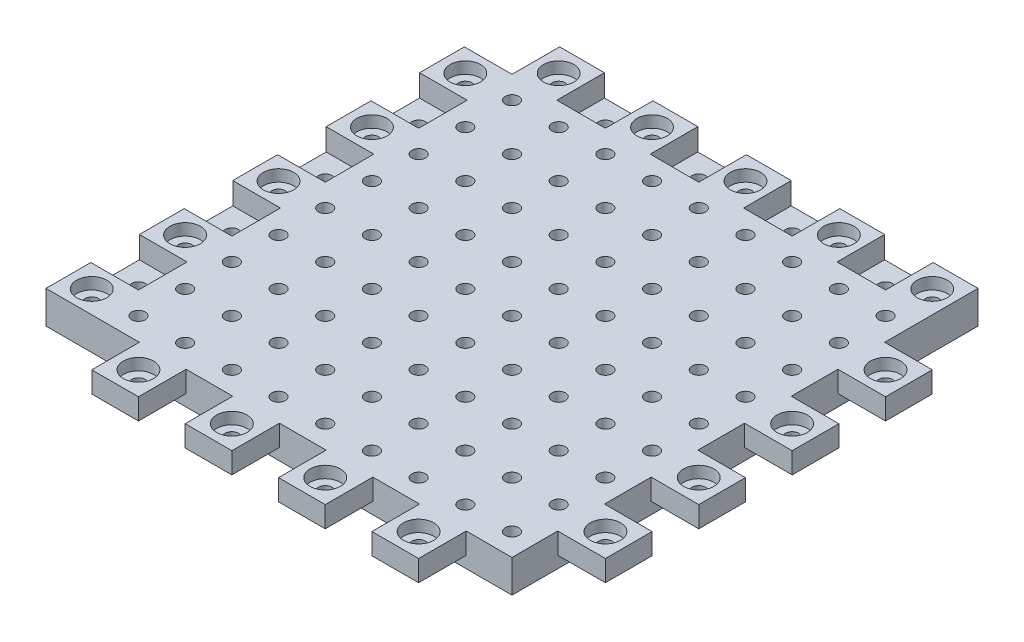
from build123d import *

# Parameters (mm, degrees)
CROQUIS1_W              = 100
CROQUIS1_H              = 100
SALIENTE_EXTRUIR1_DEPTH = 7
CROQUIS2_W              = 10.4
CROQUIS2_H              = 10.4
CORTAR_EXTRUIR1_DEPTH   = 4.7
CROQUIS3_W              = 10
CROQUIS3_H              = 10
SALIENTE_EXTRUIR2_DEPTH = 4.5
CROQUIS4_R              = 1.45
CORTAR_EXTRUIR2_DEPTH   = 7
CROQUIS5_R              = 3.25
CORTAR_EXTRUIR4_DEPTH   = 2.5
CROQUIS6_W              = 10
CROQUIS6_H              = 0.2
CROQUIS6_W_2            = 0.2
CROQUIS6_H_2            = 9.8
CORTAR_EXTRUIR5_DEPTH   = 7
CROQUIS8_W              = 10.2
CROQUIS8_H              = 10
CORTAR_EXTRUIR7_DEPTH   = 7
CROQUIS9_W              = 10.012239445
CROQUIS9_H              = 0.2
CROQUIS9_W_2            = 0.2
CROQUIS9_H_2            = 10.2
CORTAR_EXTRUIR9_DEPTH   = 2.5
CROQUIS10_W             = 0.2
CROQUIS10_H             = 0.2
CORTAR_EXTRUIR11_DEPTH  = 5
CROQUIS11_W             = 10
CROQUIS11_H             = 10.2
CROQUIS11_W_2           = 10.2
CORTAR_EXTRUIR12_DEPTH  = 10


with BuildPart() as part:
    # Croquis1 → Saliente-Extruir1 (new body)
    with BuildSketch(Plane(origin=(0, 0, 0), x_dir=(1, 0, 0), z_dir=(0, 1, 0))):
        Rectangle(CROQUIS1_W, CROQUIS1_H)
    extrude(amount=SALIENTE_EXTRUIR1_DEPTH)

    # Croquis2 → Cortar-Extruir1 (cut)
    with BuildSketch(Plane(origin=(0, 7, 0), x_dir=(1, 0, 0), z_dir=(0, 1, 0))):
        with Locations((-45, 45)):
            Rectangle(CROQUIS2_W, CROQUIS2_H)
        with Locations((-25, 45)):
            Rectangle(CROQUIS2_W, CROQUIS2_H)
        with Locations((-5, 45)):
            Rectangle(CROQUIS2_W, CROQUIS2_H)
        with Locations((15, 45)):
            Rectangle(CROQUIS2_W, CROQUIS2_H)
        with Locations((35, 45)):
            Rectangle(CROQUIS2_W, CROQUIS2_H)
        with Locations((-45, 25)):
            Rectangle(CROQUIS2_W, CROQUIS2_H)
        with Locations((-45, 5)):
            Rectangle(CROQUIS2_W, CROQUIS2_H)
        with Locations((-45, -15)):
            Rectangle(CROQUIS2_W, CROQUIS2_H)
        with Locations((-45, -35)):
            Rectangle(CROQUIS2_W, CROQUIS2_H)
    extrude(amount=-CORTAR_EXTRUIR1_DEPTH, mode=Mode.SUBTRACT)

    # Croquis3 → Saliente-Extruir2 (add)
    with BuildSketch(Plane(origin=(0, 7, 0), x_dir=(1, 0, 0), z_dir=(0, 1, 0))):
        with Locations((55, 25)):
            Rectangle(CROQUIS3_W, CROQUIS3_H)
        with Locations((55, 45)):
            Rectangle(CROQUIS3_W, CROQUIS3_H)
        with Locations((55, 5)):
            Rectangle(CROQUIS3_W, CROQUIS3_H)
        with Locations((55, -15)):
            Rectangle(CROQUIS3_W, CROQUIS3_H)
        with Locations((55, -35)):
            Rectangle(CROQUIS3_W, CROQUIS3_H)
        with Locations((-25, -55)):
            Rectangle(CROQUIS3_W, CROQUIS3_H)
        with Locations((-45, -55)):
            Rectangle(CROQUIS3_W, CROQUIS3_H)
        with Locations((-5, -55)):
            Rectangle(CROQUIS3_W, CROQUIS3_H)
        with Locations((15, -55)):
            Rectangle(CROQUIS3_W, CROQUIS3_H)
        with Locations((35, -55)):
            Rectangle(CROQUIS3_W, CROQUIS3_H)
    extrude(amount=-SALIENTE_EXTRUIR2_DEPTH)

    # Croquis4 → Cortar-Extruir2 (cut)
    with BuildSketch(Plane(origin=(0, 7, 0), x_dir=(1, 0, 0), z_dir=(0, 1, 0))):
        with Locations(Location((-45, 45, 0), (0, 0, 270))):
            Circle(CROQUIS4_R)
        with Locations(Location((-35, 45, 0), (0, 0, 270))):
            Circle(CROQUIS4_R)
        with Locations(Location((-25, 45, 0), (0, 0, 270))):
            Circle(CROQUIS4_R)
        with Locations(Location((-15, 45, 0), (0, 0, 270))):
            Circle(CROQUIS4_R)
        with Locations(Location((-5, 45, 0), (0, 0, 270))):
            Circle(CROQUIS4_R)
        with Locations(Location((5, 45, 0), (0, 0, 270))):
            Circle(CROQUIS4_R)
        with Locations(Location((15, 45, 0), (0, 0, 270))):
            Circle(CROQUIS4_R)
        with Locations(Location((25, 45, 0), (0, 0, 270))):
            Circle(CROQUIS4_R)
        with Locations(Location((35, 45, 0), (0, 0, 270))):
            Circle(CROQUIS4_R)
        with Locations(Location((45, 45, 0), (0, 0, 270))):
            Circle(CROQUIS4_R)
        with Locations(Location((55, 45, 0), (0, 0, 270))):
            Circle(CROQUIS4_R)
        with Locations(Location((-35, 35, 0), (0, 0, 270))):
            Circle(CROQUIS4_R)
        with Locations(Location((-25, 35, 0), (0, 0, 270))):
            Circle(CROQUIS4_R)
        with Locations(Location((-15, 35, 0), (0, 0, 270))):
            Circle(CROQUIS4_R)
        with Locations(Location((-5, 35, 0), (0, 0, 270))):
            Circle(CROQUIS4_R)
        with Locations(Location((5, 35, 0), (0, 0, 270))):
            Circle(CROQUIS4_R)
        with Locations(Location((15, 35, 0), (0, 0, 270))):
            Circle(CROQUIS4_R)
        with Locations(Location((25, 35, 0), (0, 0, 270))):
            Circle(CROQUIS4_R)
        with Locations(Location((35, 35, 0), (0, 0, 270))):
            Circle(CROQUIS4_R)
        with Locations(Location((45, 35, 0), (0, 0, 270))):
            Circle(CROQUIS4_R)
        with Locations((55, 35)):
            Circle(CROQUIS4_R)
        with Locations(Location((-35, 25, 0), (0, 0, 270))):
            Circle(CROQUIS4_R)
        with Locations(Location((-25, 25, 0), (0, 0, 270))):
            Circle(CROQUIS4_R)
        with Locations(Location((-15, 25, 0), (0, 0, 270))):
            Circle(CROQUIS4_R)
        with Locations(Location((-5, 25, 0), (0, 0, 270))):
            Circle(CROQUIS4_R)
        with Locations(Location((5, 25, 0), (0, 0, 270))):
            Circle(CROQUIS4_R)
        with Locations(Location((15, 25, 0), (0, 0, 270))):
            Circle(CROQUIS4_R)
        with Locations(Location((25, 25, 0), (0, 0, 270))):
            Circle(CROQUIS4_R)
        with Locations(Location((35, 25, 0), (0, 0, 270))):
            Circle(CROQUIS4_R)
        with Locations(Location((45, 25, 0), (0, 0, 270))):
            Circle(CROQUIS4_R)
        with Locations(Location((55, 25, 0), (0, 0, 270))):
            Circle(CROQUIS4_R)
        with Locations(Location((-35, 15, 0), (0, 0, 270))):
            Circle(CROQUIS4_R)
        with Locations(Location((-25, 15, 0), (0, 0, 270))):
            Circle(CROQUIS4_R)
        with Locations(Location((-15, 15, 0), (0, 0, 270))):
            Circle(CROQUIS4_R)
        with Locations(Location((-5, 15, 0), (0, 0, 270))):
            Circle(CROQUIS4_R)
        with Locations(Location((5, 15, 0), (0, 0, 270))):
            Circle(CROQUIS4_R)
        with Locations(Location((15, 15, 0), (0, 0, 270))):
            Circle(CROQUIS4_R)
        with Locations(Location((25, 15, 0), (0, 0, 270))):
            Circle(CROQUIS4_R)
        with Locations(Location((35, 15, 0), (0, 0, 270))):
            Circle(CROQUIS4_R)
        with Locations(Location((45, 15, 0), (0, 0, 270))):
            Circle(CROQUIS4_R)
        with Locations((55, 15)):
            Circle(CROQUIS4_R)
        with Locations(Location((-35, 5, 0), (0, 0, 270))):
            Circle(CROQUIS4_R)
        with Locations(Location((-25, 5, 0), (0, 0, 270))):
            Circle(CROQUIS4_R)
        with Locations(Location((-15, 5, 0), (0, 0, 270))):
            Circle(CROQUIS4_R)
        with Locations(Location((-5, 5, 0), (0, 0, 270))):
            Circle(CROQUIS4_R)
        with Locations(Location((5, 5, 0), (0, 0, 270))):
            Circle(CROQUIS4_R)
        with Locations(Location((15, 5, 0), (0, 0, 270))):
            Circle(CROQUIS4_R)
        with Locations(Location((25, 5, 0), (0, 0, 270))):
            Circle(CROQUIS4_R)
        with Locations(Location((35, 5, 0), (0, 0, 270))):
            Circle(CROQUIS4_R)
        with Locations(Location((45, 5, 0), (0, 0, 270))):
            Circle(CROQUIS4_R)
        with Locations(Location((55, 5, 0), (0, 0, 270))):
            Circle(CROQUIS4_R)
        with Locations(Location((-35, -5, 0), (0, 0, 270))):
            Circle(CROQUIS4_R)
        with Locations(Location((-25, -5, 0), (0, 0, 270))):
            Circle(CROQUIS4_R)
        with Locations(Location((-15, -5, 0), (0, 0, 270))):
            Circle(CROQUIS4_R)
        with Locations(Location((-5, -5, 0), (0, 0, 270))):
            Circle(CROQUIS4_R)
        with Locations(Location((5, -5, 0), (0, 0, 270))):
            Circle(CROQUIS4_R)
        with Locations(Location((15, -5, 0), (0, 0, 270))):
            Circle(CROQUIS4_R)
        with Locations(Location((25, -5, 0), (0, 0, 270))):
            Circle(CROQUIS4_R)
        with Locations(Location((35, -5, 0), (0, 0, 270))):
            Circle(CROQUIS4_R)
        with Locations(Location((45, -5, 0), (0, 0, 270))):
            Circle(CROQUIS4_R)
        with Locations((55, -5)):
            Circle(CROQUIS4_R)
        with Locations(Location((-35, -15, 0), (0, 0, 270))):
            Circle(CROQUIS4_R)
        with Locations(Location((-25, -15, 0), (0, 0, 270))):
            Circle(CROQUIS4_R)
        with Locations(Location((-15, -15, 0), (0, 0, 270))):
            Circle(CROQUIS4_R)
        with Locations(Location((-5, -15, 0), (0, 0, 270))):
            Circle(CROQUIS4_R)
        with Locations(Location((5, -15, 0), (0, 0, 270))):
            Circle(CROQUIS4_R)
        with Locations(Location((15, -15, 0), (0, 0, 270))):
            Circle(CROQUIS4_R)
        with Locations(Location((25, -15, 0), (0, 0, 270))):
            Circle(CROQUIS4_R)
        with Locations(Location((35, -15, 0), (0, 0, 270))):
            Circle(CROQUIS4_R)
        with Locations(Location((45, -15, 0), (0, 0, 270))):
            Circle(CROQUIS4_R)
        with Locations(Location((55, -15, 0), (0, 0, 270))):
            Circle(CROQUIS4_R)
        with Locations(Location((-35, -25, 0), (0, 0, 270))):
            Circle(CROQUIS4_R)
        with Locations(Location((-25, -25, 0), (0, 0, 270))):
            Circle(CROQUIS4_R)
        with Locations(Location((-15, -25, 0), (0, 0, 270))):
            Circle(CROQUIS4_R)
        with Locations(Location((-5, -25, 0), (0, 0, 270))):
            Circle(CROQUIS4_R)
        with Locations(Location((5, -25, 0), (0, 0, 270))):
            Circle(CROQUIS4_R)
        with Locations(Location((15, -25, 0), (0, 0, 270))):
            Circle(CROQUIS4_R)
        with Locations(Location((25, -25, 0), (0, 0, 270))):
            Circle(CROQUIS4_R)
        with Locations(Location((35, -25, 0), (0, 0, 270))):
            Circle(CROQUIS4_R)
        with Locations(Location((45, -25, 0), (0, 0, 270))):
            Circle(CROQUIS4_R)
        with Locations((55, -25)):
            Circle(CROQUIS4_R)
        with Locations(Location((-35, -35, 0), (0, 0, 270))):
            Circle(CROQUIS4_R)
        with Locations(Location((-25, -35, 0), (0, 0, 270))):
            Circle(CROQUIS4_R)
        with Locations(Location((-15, -35, 0), (0, 0, 270))):
            Circle(CROQUIS4_R)
        with Locations(Location((-5, -35, 0), (0, 0, 270))):
            Circle(CROQUIS4_R)
        with Locations(Location((5, -35, 0), (0, 0, 270))):
            Circle(CROQUIS4_R)
        with Locations(Location((15, -35, 0), (0, 0, 270))):
            Circle(CROQUIS4_R)
        with Locations(Location((25, -35, 0), (0, 0, 270))):
            Circle(CROQUIS4_R)
        with Locations(Location((35, -35, 0), (0, 0, 270))):
            Circle(CROQUIS4_R)
        with Locations(Location((45, -35, 0), (0, 0, 270))):
            Circle(CROQUIS4_R)
        with Locations(Location((55, -35, 0), (0, 0, 270))):
            Circle(CROQUIS4_R)
        with Locations(Location((-35, -45, 0), (0, 0, 270))):
            Circle(CROQUIS4_R)
        with Locations(Location((-25, -45, 0), (0, 0, 270))):
            Circle(CROQUIS4_R)
        with Locations(Location((-15, -45, 0), (0, 0, 270))):
            Circle(CROQUIS4_R)
        with Locations(Location((-5, -45, 0), (0, 0, 270))):
            Circle(CROQUIS4_R)
        with Locations(Location((5, -45, 0), (0, 0, 270))):
            Circle(CROQUIS4_R)
        with Locations(Location((15, -45, 0), (0, 0, 270))):
            Circle(CROQUIS4_R)
        with Locations(Location((25, -45, 0), (0, 0, 270))):
            Circle(CROQUIS4_R)
        with Locations(Location((35, -45, 0), (0, 0, 270))):
            Circle(CROQUIS4_R)
        with Locations(Location((45, -45, 0), (0, 0, 270))):
            Circle(CROQUIS4_R)
        with Locations((55, -45)):
            Circle(CROQUIS4_R)
        with Locations((-35, -55)):
            Circle(CROQUIS4_R)
        with Locations(Location((-25, -55, 0), (0, 0, 270))):
            Circle(CROQUIS4_R)
        with Locations((-15, -55)):
            Circle(CROQUIS4_R)
        with Locations(Location((-5, -55, 0), (0, 0, 270))):
            Circle(CROQUIS4_R)
        with Locations((5, -55)):
            Circle(CROQUIS4_R)
        with Locations(Location((15, -55, 0), (0, 0, 270))):
            Circle(CROQUIS4_R)
        with Locations((25, -55)):
            Circle(CROQUIS4_R)
        with Locations(Location((35, -55, 0), (0, 0, 270))):
            Circle(CROQUIS4_R)
        with Locations((45, -55)):
            Circle(CROQUIS4_R)
        with Locations((55, -55)):
            Circle(CROQUIS4_R)
        with Locations(Location((-45, 35, 0), (0, 0, 270))):
            Circle(CROQUIS4_R)
        with Locations(Location((-45, 25, 0), (0, 0, 270))):
            Circle(CROQUIS4_R)
        with Locations(Location((-45, 15, 0), (0, 0, 270))):
            Circle(CROQUIS4_R)
        with Locations(Location((-45, 5, 0), (0, 0, 270))):
            Circle(CROQUIS4_R)
        with Locations(Location((-45, -5, 0), (0, 0, 270))):
            Circle(CROQUIS4_R)
        with Locations(Location((-45, -15, 0), (0, 0, 270))):
            Circle(CROQUIS4_R)
        with Locations(Location((-45, -25, 0), (0, 0, 270))):
            Circle(CROQUIS4_R)
        with Locations(Location((-45, -35, 0), (0, 0, 270))):
            Circle(CROQUIS4_R)
        with Locations(Location((-45, -45, 0), (0, 0, 270))):
            Circle(CROQUIS4_R)
        with Locations(Location((-45, -55, 0), (0, 0, 270))):
            Circle(CROQUIS4_R)
    extrude(amount=-CORTAR_EXTRUIR2_DEPTH, mode=Mode.SUBTRACT)

    # Croquis5 → Cortar-Extruir4 (cut)
    with BuildSketch(Plane(origin=(0, 7, 0), x_dir=(1, 0, 0), z_dir=(0, 1, 0))):
        with Locations((-45, 45)):
            Circle(CROQUIS5_R)
        with Locations(Location((-35, 45, 0), (0, 0, 270))):
            Circle(CROQUIS5_R)
        with Locations((-25, 45)):
            Circle(CROQUIS5_R)
        with Locations(Location((-15, 45, 0), (0, 0, 270))):
            Circle(CROQUIS5_R)
        with Locations((-5, 45)):
            Circle(CROQUIS5_R)
        with Locations(Location((5, 45, 0), (0, 0, 270))):
            Circle(CROQUIS5_R)
        with Locations((15, 45)):
            Circle(CROQUIS5_R)
        with Locations(Location((25, 45, 0), (0, 0, 270))):
            Circle(CROQUIS5_R)
        with Locations((35, 45)):
            Circle(CROQUIS5_R)
        with Locations(Location((45, 45, 0), (0, 0, 270))):
            Circle(CROQUIS5_R)
        with Locations(Location((55, 45, 0), (0, 0, 270))):
            Circle(CROQUIS5_R)
        with Locations((55, 35)):
            Circle(CROQUIS5_R)
        with Locations(Location((55, 25, 0), (0, 0, 270))):
            Circle(CROQUIS5_R)
        with Locations((55, 15)):
            Circle(CROQUIS5_R)
        with Locations(Location((55, 5, 0), (0, 0, 270))):
            Circle(CROQUIS5_R)
        with Locations((55, -5)):
            Circle(CROQUIS5_R)
        with Locations(Location((55, -15, 0), (0, 0, 270))):
            Circle(CROQUIS5_R)
        with Locations((55, -25)):
            Circle(CROQUIS5_R)
        with Locations(Location((55, -35, 0), (0, 0, 270))):
            Circle(CROQUIS5_R)
        with Locations((55, -45)):
            Circle(CROQUIS5_R)
        with Locations((-35, -55)):
            Circle(CROQUIS5_R)
        with Locations(Location((-25, -55, 0), (0, 0, 270))):
            Circle(CROQUIS5_R)
        with Locations((-15, -55)):
            Circle(CROQUIS5_R)
        with Locations(Location((-5, -55, 0), (0, 0, 270))):
            Circle(CROQUIS5_R)
        with Locations((5, -55)):
            Circle(CROQUIS5_R)
        with Locations(Location((15, -55, 0), (0, 0, 270))):
            Circle(CROQUIS5_R)
        with Locations((25, -55)):
            Circle(CROQUIS5_R)
        with Locations(Location((35, -55, 0), (0, 0, 270))):
            Circle(CROQUIS5_R)
        with Locations((45, -55)):
            Circle(CROQUIS5_R)
        with Locations((55, -55)):
            Circle(CROQUIS5_R)
        with Locations(Location((-45, 35, 0), (0, 0, 270))):
            Circle(CROQUIS5_R)
        with Locations((-45, 25)):
            Circle(CROQUIS5_R)
        with Locations(Location((-45, 15, 0), (0, 0, 270))):
            Circle(CROQUIS5_R)
        with Locations((-45, 5)):
            Circle(CROQUIS5_R)
        with Locations(Location((-45, -5, 0), (0, 0, 270))):
            Circle(CROQUIS5_R)
        with Locations((-45, -15)):
            Circle(CROQUIS5_R)
        with Locations(Location((-45, -25, 0), (0, 0, 270))):
            Circle(CROQUIS5_R)
        with Locations((-45, -35)):
            Circle(CROQUIS5_R)
        with Locations(Location((-45, -45, 0), (0, 0, 270))):
            Circle(CROQUIS5_R)
        with Locations(Location((-45, -55, 0), (0, 0, 270))):
            Circle(CROQUIS5_R)
    extrude(amount=-CORTAR_EXTRUIR4_DEPTH, mode=Mode.SUBTRACT)

    # Croquis6 → Cortar-Extruir5 (cut)
    with BuildSketch(Plane(origin=(0, 7, 0), x_dir=(1, 0, 0), z_dir=(0, 1, 0))):
        Polygon((50, -50), (40, -50), (40, -49.8), (49.8, -49.8), (49.8, -40), (50, -40), (50, -49.8), align=None)
        with Locations((25, -49.9)):
            Rectangle(CROQUIS6_W, CROQUIS6_H)
        with Locations((5, -49.9)):
            Rectangle(CROQUIS6_W, CROQUIS6_H)
        with Locations((-15, -49.9)):
            Rectangle(CROQUIS6_W, CROQUIS6_H)
        with Locations((-35, -49.9)):
            Rectangle(CROQUIS6_W, CROQUIS6_H)
        with Locations((49.9, -24.9)):
            Rectangle(CROQUIS6_W_2, CROQUIS6_H_2)
        with Locations((49.9, -4.9)):
            Rectangle(CROQUIS6_W_2, CROQUIS6_H_2)
        with Locations((49.9, 15.1)):
            Rectangle(CROQUIS6_W_2, CROQUIS6_H_2)
        with Locations((49.9, 35.1)):
            Rectangle(CROQUIS6_W_2, CROQUIS6_H_2)
    extrude(amount=-CORTAR_EXTRUIR5_DEPTH, mode=Mode.SUBTRACT)

    # Croquis8 → Cortar-Extruir7 (cut)
    with BuildSketch(Plane(origin=(0, 7, 0), x_dir=(1, 0, 0), z_dir=(0, 1, 0))):
        with Locations((54.9, 45)):
            Rectangle(CROQUIS8_W, CROQUIS8_H)
    extrude(amount=-CORTAR_EXTRUIR7_DEPTH, mode=Mode.SUBTRACT)

    # Croquis9 → Cortar-Extruir9 (cut)
    with BuildSketch(Plane.XZ):
        with Locations((-45.006119723, 49.9)):
            Rectangle(CROQUIS9_W, CROQUIS9_H)
        with Locations((-25.006119723, 49.9)):
            Rectangle(CROQUIS9_W, CROQUIS9_H)
        with Locations((-5.006119723, 49.9)):
            Rectangle(CROQUIS9_W, CROQUIS9_H)
        with Locations((14.993880278, 49.9)):
            Rectangle(CROQUIS9_W, CROQUIS9_H)
        with Locations((34.993880277, 49.9)):
            Rectangle(CROQUIS9_W, CROQUIS9_H)
        with Locations((49.9, -25.1)):
            Rectangle(CROQUIS9_W_2, CROQUIS9_H_2)
        with Locations((49.9, -5.1)):
            Rectangle(CROQUIS9_W_2, CROQUIS9_H_2)
        with Locations((49.9, 14.9)):
            Rectangle(CROQUIS9_W_2, CROQUIS9_H_2)
        with Locations((49.9, 34.9)):
            Rectangle(CROQUIS9_W_2, CROQUIS9_H_2)
    extrude(amount=-CORTAR_EXTRUIR9_DEPTH, mode=Mode.SUBTRACT)

    # Croquis10 → Cortar-Extruir11 (cut)
    with BuildSketch(Plane.XZ.offset(-2.5)):
        with Locations((49.9, 29.9)):
            Rectangle(CROQUIS10_W, CROQUIS10_H)
        with Locations((49.9, 9.9)):
            Rectangle(CROQUIS10_W, CROQUIS10_H)
        with Locations((49.9, -10.1)):
            Rectangle(CROQUIS10_W, CROQUIS10_H)
        with Locations((49.9, -30.1)):
            Rectangle(CROQUIS10_W, CROQUIS10_H)
    extrude(amount=-CORTAR_EXTRUIR11_DEPTH, mode=Mode.SUBTRACT)

    # Croquis11 → Cortar-Extruir12 (cut)
    with BuildSketch(Plane(origin=(0, 7, 0), x_dir=(1, 0, 0), z_dir=(0, 1, 0))):
        with Locations((-45, -54.9)):
            Rectangle(CROQUIS11_W, CROQUIS11_H)
        with Locations((-44.9, 44.9)):
            Rectangle(CROQUIS11_W_2, CROQUIS11_H)
    extrude(amount=-CORTAR_EXTRUIR12_DEPTH, mode=Mode.SUBTRACT)


solid = part.part
